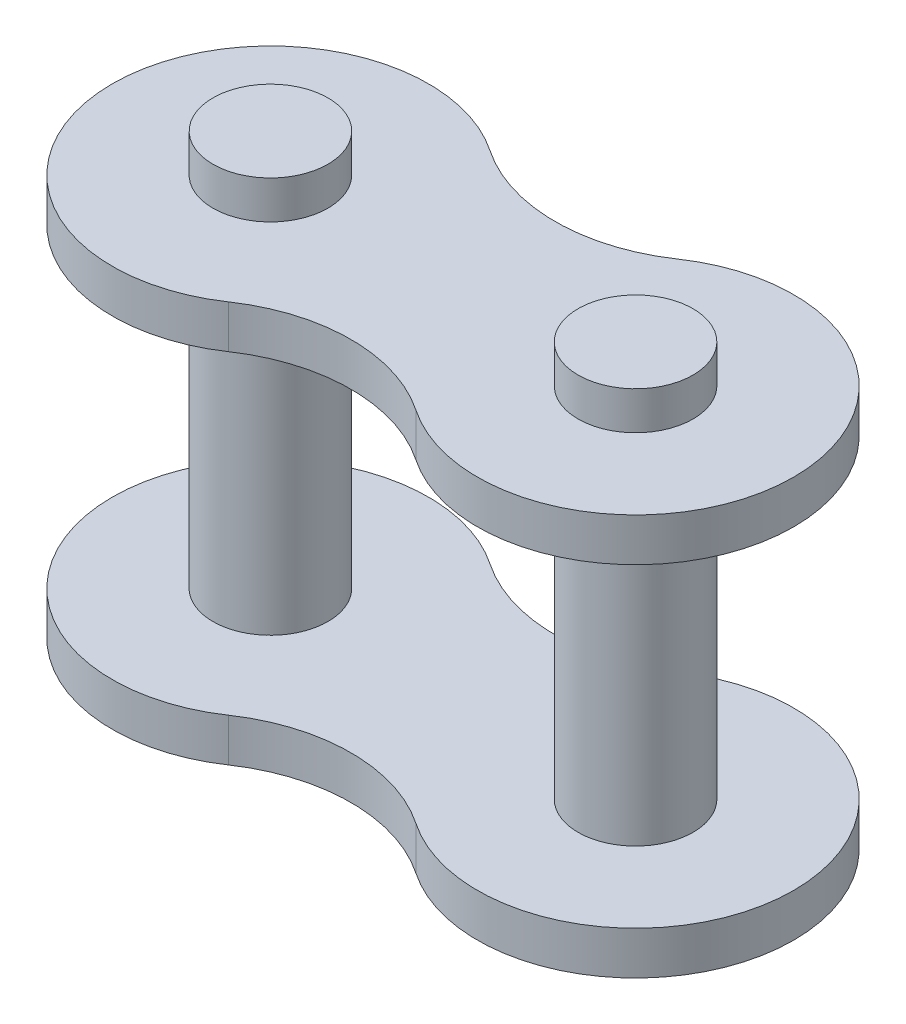
from build123d import *

# Parameters (mm, degrees)
ESBO_O5_R                = 2
RESSALTO_EXTRUS_O1_DEPTH = 1.5
ESBO_O10_R               = 2
RESSALTO_EXTRUS_O2_DEPTH = 1.5
ESBO_O16_W               = 2
ESBO_O16_H               = 16.6
ESBO_O23_W               = 2
ESBO_O23_H               = 16.6


with BuildPart() as part:
    # Esboço5 → Ressalto-extrusão1 (new body)
    with BuildSketch(Plane(origin=(0, 6.975, 0), x_dir=(1, 0, 0), z_dir=(0, 1, 0))):
        with BuildLine():
            ThreePointArc((3.263144476, 4.552067989), (0, 3.55), (-3.263144476, 4.552067989))
            ThreePointArc((-3.263144476, 4.552067989), (-11.85, 0), (-3.263144476, -4.552067989))
            ThreePointArc((-3.263144476, -4.552067989), (0, -3.55), (3.263144476, -4.552067989))
            ThreePointArc((3.263144476, -4.552067989), (11.85, 0), (3.263144476, 4.552067989))
        make_face()
        with Locations(Location((6.35, 0, 0), (0, 0, 270))):
            Circle(ESBO_O5_R, mode=Mode.SUBTRACT)
        with Locations(Location((-6.35, 0, 0), (0, 0, 270))):
            Circle(ESBO_O5_R, mode=Mode.SUBTRACT)
    extrude(amount=-RESSALTO_EXTRUS_O1_DEPTH)


with BuildPart() as body_2:
    # Esboço10 → Ressalto-extrusão2 (new body)
    with BuildSketch(Plane(origin=(0, -6.975, 0), x_dir=(-1, 0, 0), z_dir=(0, -1, 0))):
        with BuildLine():
            ThreePointArc((3.263144476, 4.552067989), (0, 3.55), (-3.263144476, 4.552067989))
            ThreePointArc((-3.263144476, 4.552067989), (-11.85, 0), (-3.263144476, -4.552067989))
            ThreePointArc((-3.263144476, -4.552067989), (0, -3.55), (3.263144476, -4.552067989))
            ThreePointArc((3.263144476, -4.552067989), (11.85, 0), (3.263144476, 4.552067989))
        make_face()
        with Locations(Location((-6.35, 0, 0), (0, 0, 90))):
            Circle(ESBO_O10_R, mode=Mode.SUBTRACT)
        with Locations(Location((6.35, 0, 0), (0, 0, 90))):
            Circle(ESBO_O10_R, mode=Mode.SUBTRACT)
    extrude(amount=-RESSALTO_EXTRUS_O2_DEPTH)


with BuildPart() as body_3:
    # Esboço16 → Revolução2 (revolve)
    with BuildSketch(Plane(origin=(0, 0, 0), x_dir=(-1, 0, 0), z_dir=(0, 0, -1)), mode=Mode.PRIVATE) as revolu_o2_sk:
        with Locations((5.35, 0)):
            Rectangle(ESBO_O16_W, ESBO_O16_H)
    revolve(revolu_o2_sk.sketch.rotate(Axis((-6.35, -8.3, 0), (0, 1, 0)), 270), axis=Axis((-6.35, -8.3, 0), (0, 1, 0)))


with BuildPart() as body_4:
    # Esboço23 → Revolução3 (revolve)
    with BuildSketch(Plane(origin=(0, 0, 0), x_dir=(-1, 0, 0), z_dir=(0, 0, -1)), mode=Mode.PRIVATE) as revolu_o3_sk:
        with Locations((-7.35, 0)):
            Rectangle(ESBO_O23_W, ESBO_O23_H)
    revolve(revolu_o3_sk.sketch.rotate(Axis((6.35, -8.3, 0), (0, 1, 0)), 270), axis=Axis((6.35, -8.3, 0), (0, 1, 0)))


solid = Compound([part.part, body_2.part, body_3.part, body_4.part])
